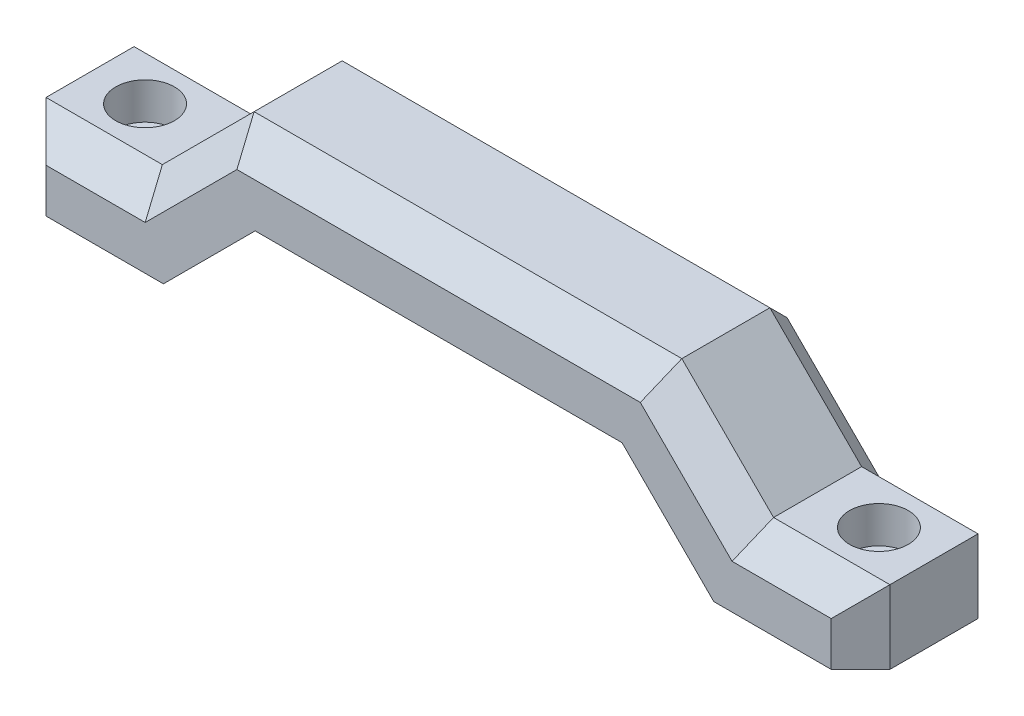
from build123d import *

# Parameters (mm, degrees)
BOSS_EXTRUDE1_DEPTH = 20
CHAMFER1_SIZE       = 4
SKETCH2_R           = 1.75
CUT_EXTRUDE1_DEPTH  = 63.149014473
SKETCH3_R           = 4
CUT_EXTRUDE2_DEPTH  = 5


with BuildPart() as part:
    # Sketch1 → Boss-Extrude1 (new body)
    with BuildSketch(Plane.XY):
        Polygon((-25, 0), (25, 0), (37.5, -12.5), (57.5, -12.5), (57.5, -2.5), (41.642135624, -2.5), (29.142135624, 10), (-29.142135624, 10), (-41.642135624, -2.5), (-57.5, -2.5), (-57.5, -12.5), (-37.5, -12.5), align=None)
    extrude(amount=BOSS_EXTRUDE1_DEPTH)

    # Chamfer1
    chamfer1_edges = [part.edges().sort_by_distance(p)[0] for p in [
        (-57.5, -7.5, 0),
        (-49.571067812, -2.5, 0),
        (-35.392135624, 3.75, 0),
        (0, 10, 0),
        (35.392135624, 3.75, 0),
        (49.571067812, -2.5, 0),
        (57.5, -7.5, 0),
        (57.5, -7.5, 20),
        (49.571067812, -2.5, 20),
        (35.392135624, 3.75, 20),
        (0, 10, 20),
        (-35.392135624, 3.75, 20),
        (-49.571067812, -2.5, 20),
        (-57.5, -7.5, 20),
    ]]
    chamfer(chamfer1_edges, length=CHAMFER1_SIZE)

    # Sketch2 → Cut-Extrude1 (cut, through all)
    with BuildSketch(Plane(origin=(0, -2.5, 0), x_dir=(1, 0, 0), z_dir=(0, 1, 0))):
        with Locations(Location((-50, -10, 0), (0, 0, 180))):
            Circle(SKETCH2_R)
        with Locations(Location((50, -10, 0), (0, 0, 180))):
            Circle(SKETCH2_R)
    extrude(amount=-CUT_EXTRUDE1_DEPTH, mode=Mode.SUBTRACT)

    # Sketch3 → Cut-Extrude2 (cut)
    with BuildSketch(Plane(origin=(0, -2.5, 0), x_dir=(1, 0, 0), z_dir=(0, 1, 0))):
        with Locations(Location((-50, -10, 0), (0, 0, 180))):
            Circle(SKETCH3_R)
        with Locations(Location((50, -10, 0), (0, 0, 180))):
            Circle(SKETCH3_R)
    extrude(amount=-CUT_EXTRUDE2_DEPTH, mode=Mode.SUBTRACT)


solid = part.part
